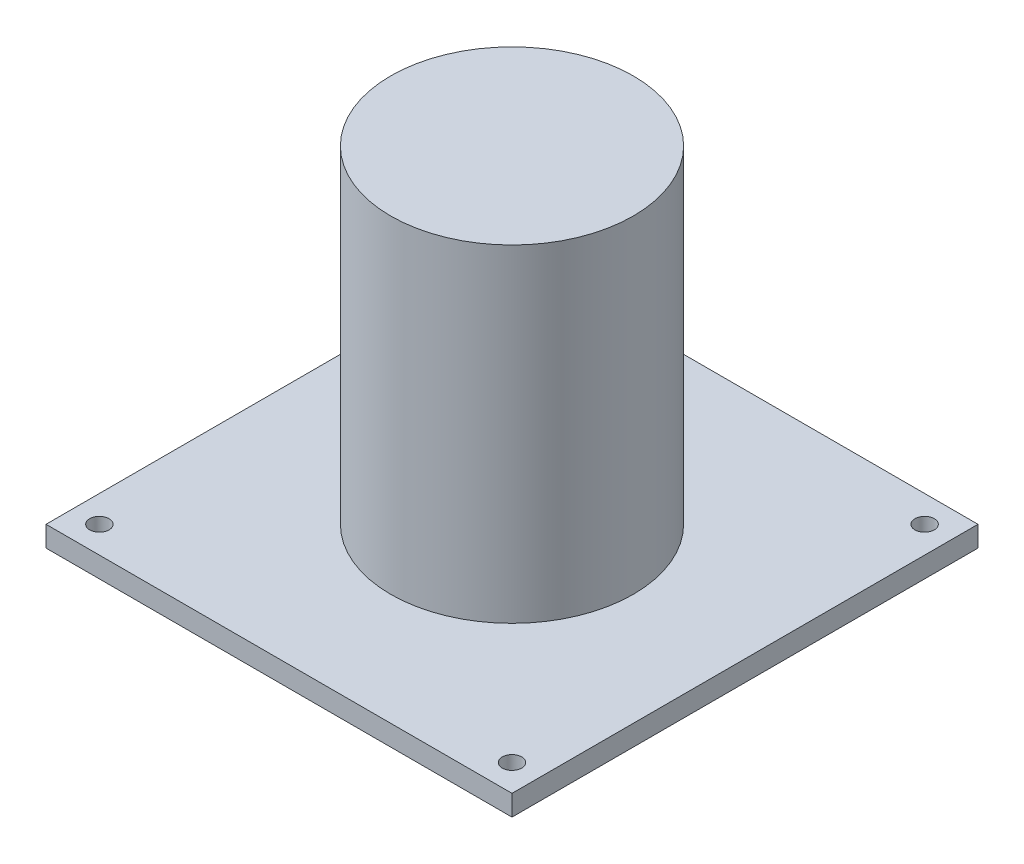
from build123d import *

# Parameters (mm, degrees)
SKETCH_1_W          = 38.4
SKETCH_1_H          = 38.4
EXTRUDE_1_DEPTH     = 1.7
SKETCH_2_R          = 10
EXTRUDE_2_DEPTH     = 27
SKETCH_3_R          = 0.8
CUT_EXTRUDE_1_DEPTH = 10


with BuildPart() as part:
    # 草图1 → 凸台-拉伸1 (new body)
    with BuildSketch(Plane(origin=(0, 0, 0), x_dir=(1, 0, 0), z_dir=(0, 1, 0))):
        Rectangle(SKETCH_1_W, SKETCH_1_H)
    extrude(amount=EXTRUDE_1_DEPTH)

    # 草图2 → 凸台-拉伸2 (add)
    with BuildSketch(Plane(origin=(0, 1.7, 0), x_dir=(1, 0, 0), z_dir=(0, 1, 0))):
        with Locations(Location((0, 0, 0), (0, 0, 270))):
            Circle(SKETCH_2_R)
    extrude(amount=EXTRUDE_2_DEPTH)

    # 草图3 → 切除-拉伸1 (cut)
    with BuildSketch(Plane.XZ):
        with Locations(Location((-17, 17, 0), (0, 0, 270))):
            Circle(SKETCH_3_R)
        with Locations(Location((17, 17, 0), (0, 0, 270))):
            Circle(SKETCH_3_R)
        with Locations(Location((17, -17, 0), (0, 0, 270))):
            Circle(SKETCH_3_R)
        with Locations(Location((-17, -17, 0), (0, 0, 270))):
            Circle(SKETCH_3_R)
    extrude(amount=-CUT_EXTRUDE_1_DEPTH, mode=Mode.SUBTRACT)


solid = part.part
